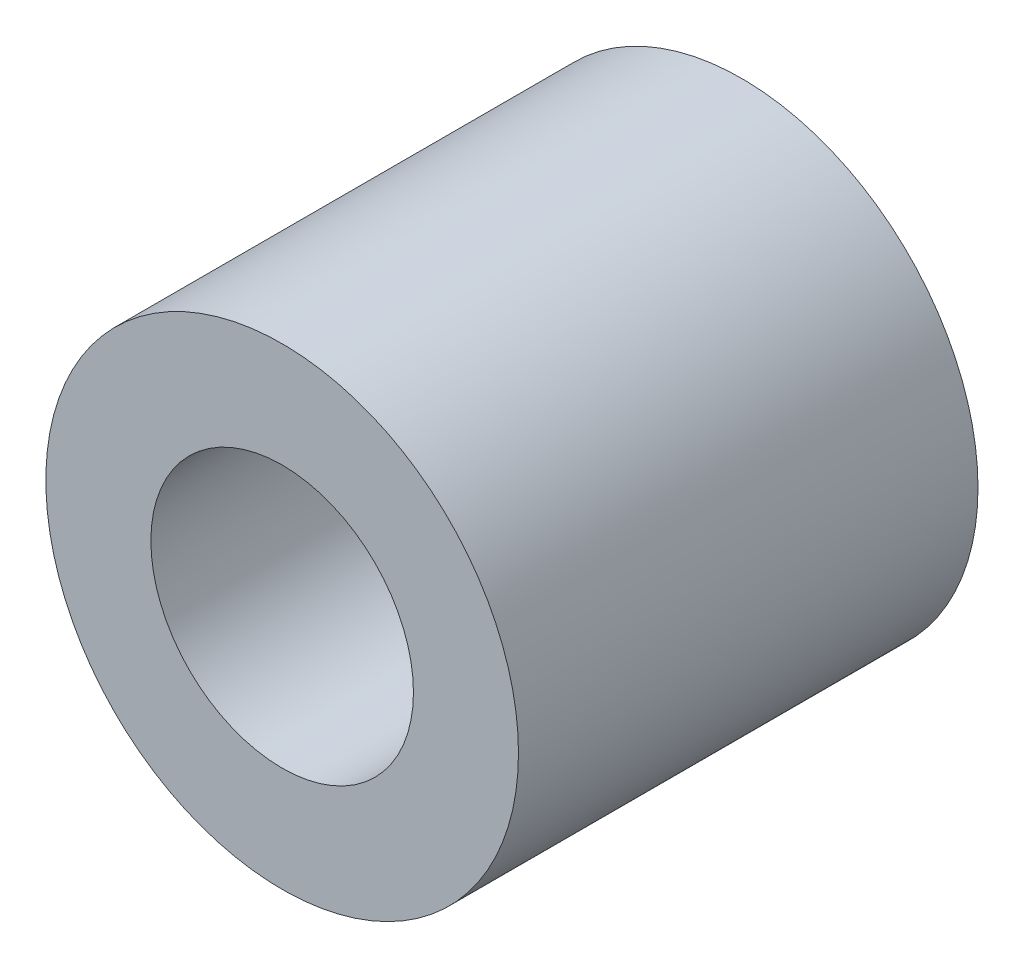
from build123d import *

# Parameters (mm, degrees)
ESQUISSE1_R        = 9
ESQUISSE1_R_2      = 5
BOSS_EXTRU_1_DEPTH = 17.5


with BuildPart() as part:
    # Esquisse1 → Boss.-Extru.1 (new body)
    with BuildSketch(Plane.XY):
        Circle(ESQUISSE1_R)
        Circle(ESQUISSE1_R_2, mode=Mode.SUBTRACT)
    extrude(amount=BOSS_EXTRU_1_DEPTH)


solid = part.part
